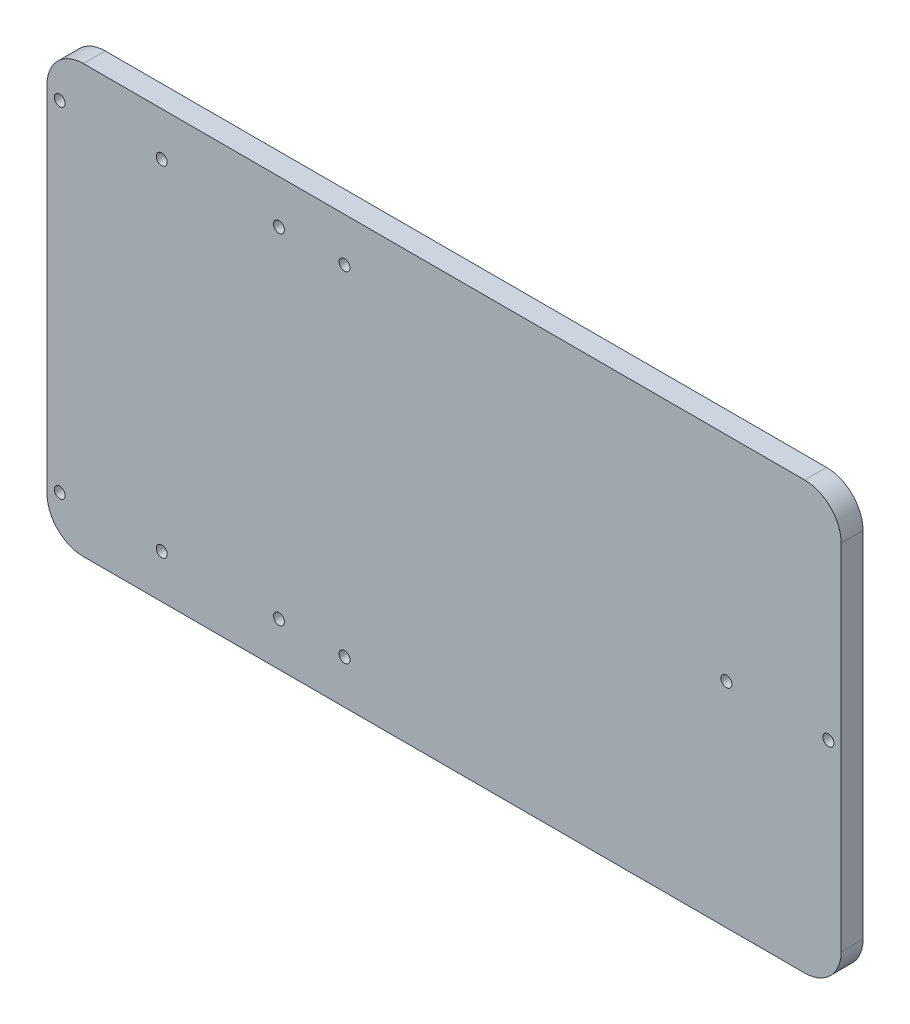
from build123d import *

# Parameters (mm, degrees)
SKETCH1_W           = 218
SKETCH1_H           = 117.2
SKETCH1_R           = 1.5
BOSS_EXTRUDE1_DEPTH = 6
SKETCH2_R           = 1.5
CUT_EXTRUDE1_DEPTH  = 6
FILLET1_R           = 10


with BuildPart() as part:
    # Sketch1 → Boss-Extrude1 (new body)
    with BuildSketch(Plane.XY):
        with Locations((-150.609177744, 197.743600407)):
            Rectangle(SKETCH1_W, SKETCH1_H)
        with Locations((-256.109177744, 244.343600407)):
            Circle(SKETCH1_R, mode=Mode.SUBTRACT)
        with Locations((-256.109177744, 151.143600407)):
            Circle(SKETCH1_R, mode=Mode.SUBTRACT)
        with Locations((-45.109177744, 197.743600407)):
            Circle(SKETCH1_R, mode=Mode.SUBTRACT)
        with Locations((-73.109177744, 197.743600407)):
            Circle(SKETCH1_R, mode=Mode.SUBTRACT)
        with Locations((-228.109177744, 244.343600407)):
            Circle(SKETCH1_R, mode=Mode.SUBTRACT)
        with Locations((-228.109177744, 151.143600407)):
            Circle(SKETCH1_R, mode=Mode.SUBTRACT)
    extrude(amount=BOSS_EXTRUDE1_DEPTH)

    # Sketch2 → Cut-Extrude1 (cut)
    with BuildSketch(Plane.XY.offset(6)):
        with Locations((-195.942511077, 151.143600407)):
            Circle(SKETCH2_R)
        with Locations((-177.942511077, 151.143600407)):
            Circle(SKETCH2_R)
        with Locations((-195.942511077, 244.343600407)):
            Circle(SKETCH2_R)
        with Locations((-177.942511077, 244.343600407)):
            Circle(SKETCH2_R)
    extrude(amount=-CUT_EXTRUDE1_DEPTH, mode=Mode.SUBTRACT)

    # Fillet1
    fillet1_edges = [part.edges().sort_by_distance(p)[0] for p in [
        (-259.609177744, 256.343600407, 3),
        (-41.609177744, 256.343600407, 3),
        (-41.609177744, 139.143600407, 3),
        (-259.609177744, 139.143600407, 3),
    ]]
    fillet(fillet1_edges, radius=FILLET1_R)


solid = part.part
